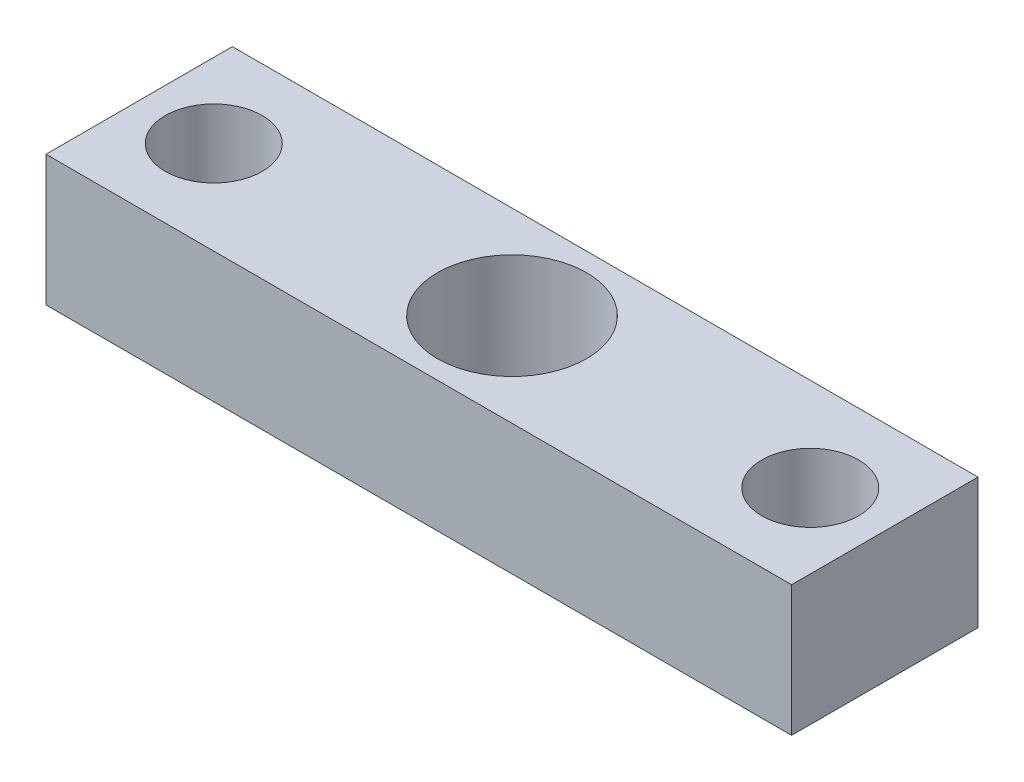
from build123d import *

# Parameters (mm, degrees)
SKETCH_1_W      = 40
SKETCH_1_H      = 10
SKETCH_1_R      = 2.6
SKETCH_1_R_2    = 4
EXTRUDE_1_DEPTH = 7


with BuildPart() as part:
    # 草图1 → 凸台-拉伸1 (new body)
    with BuildSketch(Plane(origin=(0, 0, 0), x_dir=(1, 0, 0), z_dir=(0, 1, 0))):
        Rectangle(SKETCH_1_W, SKETCH_1_H)
        with Locations(Location((-16, 0, 0), (0, 0, 270))):
            Circle(SKETCH_1_R, mode=Mode.SUBTRACT)
        with Locations(Location((16, 0, 0), (0, 0, 270))):
            Circle(SKETCH_1_R, mode=Mode.SUBTRACT)
        with Locations(Location((0, 0, 0), (0, 0, 270))):
            Circle(SKETCH_1_R_2, mode=Mode.SUBTRACT)
    extrude(amount=EXTRUDE_1_DEPTH)


solid = part.part
